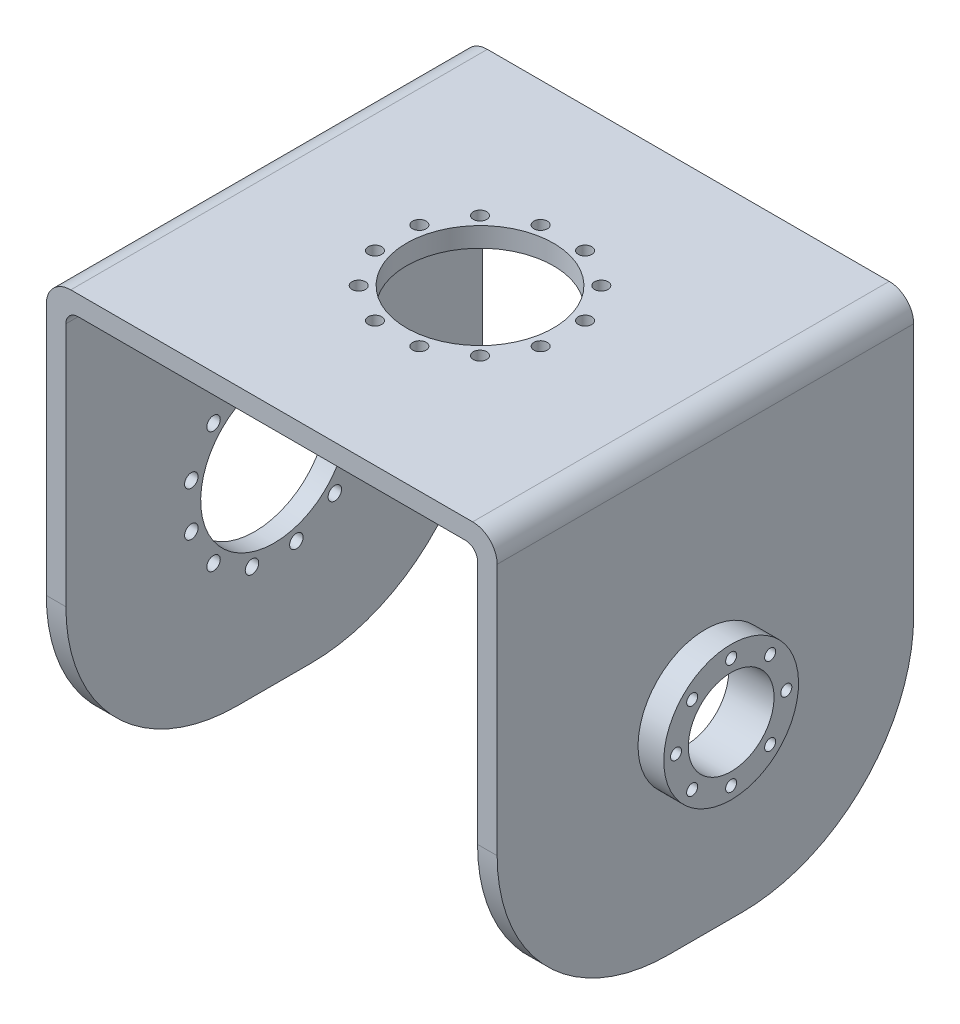
from build123d import *

# Parameters (mm, degrees)
EXTRUDE_1_DEPTH          = 170
SKETCH_2_R               = 30
CUT_EXTRUDE_1_DEPTH      = 180
CUT_EXTRUDE_2_DEPTH      = 306.583049268
CUT_EXTRUDE_2_DEPTH_BACK = 306.583049268
SKETCH_3_R               = 17.5
FILLET_1_R               = 70
FILLET_2_R               = 5
FILLET_3_R               = 10
SKETCH_6_R               = 30
CUT_EXTRUDE_6_DEPTH      = 39
SKETCH_12_R              = 2.75
CUT_EXTRUDE_12_DEPTH     = 10
EXTRUDE_START            = 10.5
SKETCH_14_R              = 27.5
SKETCH_14_R_2            = 17.5
EXTRUDE_2_DEPTH          = 10.5
SKETCH_13_R              = 2.25
CUT_EXTRUDE_13_DEPTH     = 15
SKETCH_15_R              = 2.75
CUT_EXTRUDE_14_DEPTH     = 10


with BuildPart() as part:
    # 草图1 → 凸台-拉伸1 (new body)
    with BuildSketch(Plane.XY):
        Polygon((-168, 0), (0, 0), (0, -175), (8, -175), (8, 8), (-168, 8), (-176, 8), (-176, -175), (-168, -175), align=None)
    extrude(amount=EXTRUDE_1_DEPTH)

    # 草图2 → 切除-拉伸1 (cut)
    with BuildSketch(Plane(origin=(0, 8, 0), x_dir=(1, 0, 0), z_dir=(0, 1, 0))):
        with Locations(Location((-84, -85, 0), (0, 0, 180))):
            Circle(SKETCH_2_R)
    extrude(amount=-CUT_EXTRUDE_1_DEPTH, mode=Mode.SUBTRACT)

    # 草图3 → 切除-拉伸2 (cut, two sides: drawn at the far end of the back side and taken through both)
    with BuildSketch(Plane(origin=(8, 0, 0), x_dir=(0, 0, -1), z_dir=(1, 0, 0)).offset(-CUT_EXTRUDE_2_DEPTH_BACK)):
        with Locations(Location((-85, -95, 0), (0, 0, 90))):
            Circle(SKETCH_3_R)
    extrude(amount=CUT_EXTRUDE_2_DEPTH + CUT_EXTRUDE_2_DEPTH_BACK, mode=Mode.SUBTRACT)

    # 圆角1
    fillet_1_edges = [part.edges().sort_by_distance(p)[0] for p in [
        (4, -175, 0),
        (4, -175, 170),
        (-172, -175, 170),
        (-172, -175, 0),
    ]]
    fillet(fillet_1_edges, radius=FILLET_1_R)

    # 圆角2
    fillet_2_edges = [part.edges().sort_by_distance(p)[0] for p in [
        (0, 0, 85),
        (-168, 0, 85),
    ]]
    fillet(fillet_2_edges, radius=FILLET_2_R)

    # 圆角3
    fillet_3_edges = [part.edges().sort_by_distance(p)[0] for p in [
        (-176, 8, 85),
        (8, 8, 85),
    ]]
    fillet(fillet_3_edges, radius=FILLET_3_R)

    # 草图6 → 切除-拉伸6 (cut)
    with BuildSketch(Plane.ZY.offset(176)):
        with Locations(Location((85, -95, 0), (0, 0, 270))):
            Circle(SKETCH_6_R)
    extrude(amount=-CUT_EXTRUDE_6_DEPTH, mode=Mode.SUBTRACT)

    # 草图12 → 切除-拉伸12 (cut)
    with BuildSketch(Plane.ZY.offset(176)):
        with Locations(Location((94.058666579, -128.80740392, 0), (0, 0, 270))):
            Circle(SKETCH_12_R)
        with Locations(Location((75.941333421, -128.80740392, 0), (0, 0, 270))):
            Circle(SKETCH_12_R)
        with Locations(Location((60.251262658, -119.748737342, 0), (0, 0, 270))):
            Circle(SKETCH_12_R)
        with Locations(Location((51.19259608, -104.058666579, 0), (0, 0, 270))):
            Circle(SKETCH_12_R)
        with Locations(Location((51.19259608, -85.941333421, 0), (0, 0, 270))):
            Circle(SKETCH_12_R)
        with Locations(Location((60.251262658, -70.251262658, 0), (0, 0, 270))):
            Circle(SKETCH_12_R)
        with Locations(Location((75.941333421, -61.19259608, 0), (0, 0, 270))):
            Circle(SKETCH_12_R)
        with Locations(Location((94.058666579, -61.19259608, 0), (0, 0, 270))):
            Circle(SKETCH_12_R)
        with Locations(Location((109.748737342, -70.251262658, 0), (0, 0, 270))):
            Circle(SKETCH_12_R)
        with Locations(Location((118.80740392, -85.941333421, 0), (0, 0, 270))):
            Circle(SKETCH_12_R)
        with Locations(Location((118.80740392, -104.058666579, 0), (0, 0, 270))):
            Circle(SKETCH_12_R)
        with Locations(Location((109.748737342, -119.748737342, 0), (0, 0, 270))):
            Circle(SKETCH_12_R)
    extrude(amount=-CUT_EXTRUDE_12_DEPTH, mode=Mode.SUBTRACT)

    # 草图14 → 凸台-拉伸2 (add)
    with BuildSketch(Plane(origin=(8, 0, 0), x_dir=(0, 0, -1), z_dir=(1, 0, 0)).offset(EXTRUDE_START)):
        with Locations(Location((-85, -95, 0), (0, 0, 270))):
            Circle(SKETCH_14_R)
        with Locations(Location((-85, -95, 0), (0, 0, 90))):
            Circle(SKETCH_14_R_2, mode=Mode.SUBTRACT)
    extrude(amount=-EXTRUDE_2_DEPTH)

    # 草图13 → 切除-拉伸13 (cut, symmetric)
    with BuildSketch(Plane(origin=(8, 0, 0), x_dir=(0, 0, -1), z_dir=(1, 0, 0))):
        with Locations(Location((-85, -72.5, 0), (0, 0, 90))):
            Circle(SKETCH_13_R)
        with Locations(Location((-69.090097423, -79.090097423, 0), (0, 0, 90))):
            Circle(SKETCH_13_R)
        with Locations(Location((-62.5, -95, 0), (0, 0, 90))):
            Circle(SKETCH_13_R)
        with Locations(Location((-69.090097423, -110.909902577, 0), (0, 0, 90))):
            Circle(SKETCH_13_R)
        with Locations(Location((-85, -117.5, 0), (0, 0, 90))):
            Circle(SKETCH_13_R)
        with Locations(Location((-100.909902577, -110.909902577, 0), (0, 0, 90))):
            Circle(SKETCH_13_R)
        with Locations(Location((-107.5, -95, 0), (0, 0, 90))):
            Circle(SKETCH_13_R)
        with Locations(Location((-100.909902577, -79.090097423, 0), (0, 0, 90))):
            Circle(SKETCH_13_R)
    extrude(amount=CUT_EXTRUDE_13_DEPTH, both=True, mode=Mode.SUBTRACT)

    # 草图15 → 切除-拉伸14 (cut)
    with BuildSketch(Plane(origin=(0, 8, 0), x_dir=(1, 0, 0), z_dir=(0, 1, 0))):
        with Locations(Location((-74.941333421, -118.80740392, 0), (0, 0, 270))):
            Circle(SKETCH_15_R)
        with Locations(Location((-93.058666579, -118.80740392, 0), (0, 0, 270))):
            Circle(SKETCH_15_R)
        with Locations(Location((-108.748737342, -109.748737342, 0), (0, 0, 270))):
            Circle(SKETCH_15_R)
        with Locations(Location((-117.80740392, -94.058666579, 0), (0, 0, 270))):
            Circle(SKETCH_15_R)
        with Locations(Location((-117.80740392, -75.941333421, 0), (0, 0, 270))):
            Circle(SKETCH_15_R)
        with Locations(Location((-108.748737342, -60.251262658, 0), (0, 0, 270))):
            Circle(SKETCH_15_R)
        with Locations(Location((-93.058666579, -51.19259608, 0), (0, 0, 270))):
            Circle(SKETCH_15_R)
        with Locations(Location((-74.941333421, -51.19259608, 0), (0, 0, 270))):
            Circle(SKETCH_15_R)
        with Locations(Location((-59.251262658, -60.251262658, 0), (0, 0, 270))):
            Circle(SKETCH_15_R)
        with Locations(Location((-50.19259608, -75.941333421, 0), (0, 0, 270))):
            Circle(SKETCH_15_R)
        with Locations(Location((-50.19259608, -94.058666579, 0), (0, 0, 270))):
            Circle(SKETCH_15_R)
        with Locations(Location((-59.251262658, -109.748737342, 0), (0, 0, 270))):
            Circle(SKETCH_15_R)
    extrude(amount=-CUT_EXTRUDE_14_DEPTH, mode=Mode.SUBTRACT)


solid = part.part
